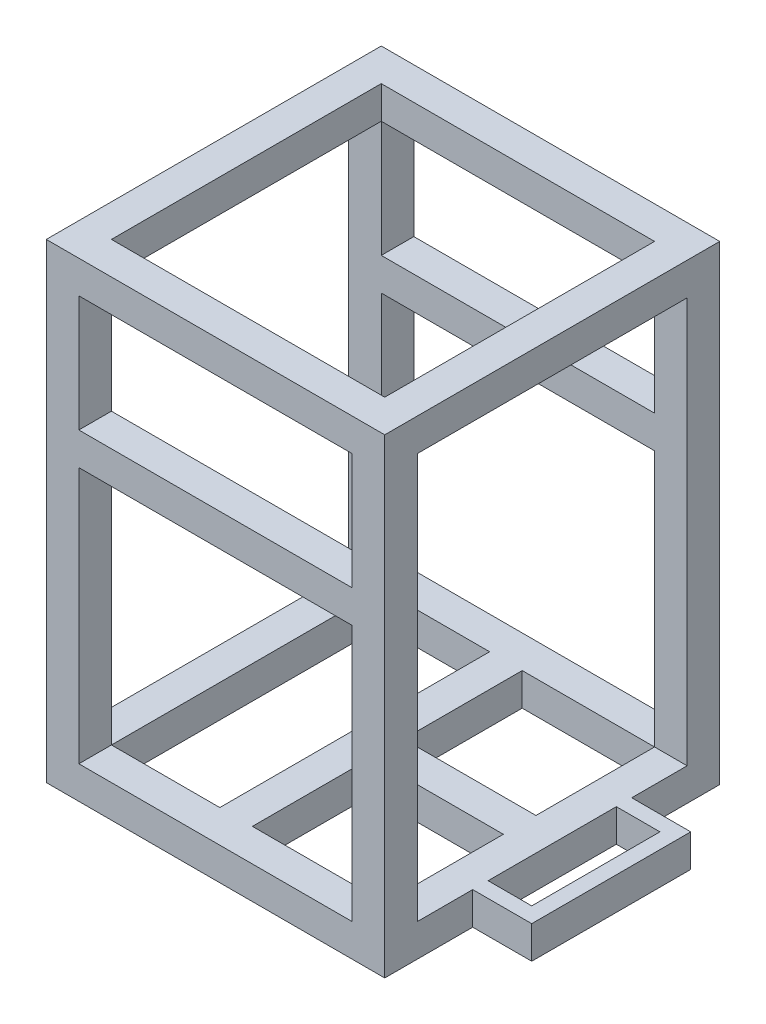
from build123d import *

# Parameters (mm, degrees)
CROQUIS1_W              = 131.9512
CROQUIS1_H              = 130.6
CROQUIS1_W_2            = 42.2512
CROQUIS1_H_2            = 105.2
CROQUIS1_W_3            = 51.6
CROQUIS1_H_3            = 46.25
SALIENTE_EXTRUIR1_DEPTH = 12.7
CROQUIS2_W              = 12.7
CROQUIS2_H              = 12.7
SALIENTE_EXTRUIR2_DEPTH = 158
CROQUIS3_W              = 131.9512
CROQUIS3_H              = 130.6
CROQUIS3_W_2            = 106.5512
CROQUIS3_H_2            = 105.2
SALIENTE_EXTRUIR3_DEPTH = 12.7
SALIENTE_EXTRUIR4_REACH = 256.78
CROQUIS4_W              = 12.7
CROQUIS4_H              = 12.7
SALIENTE_EXTRUIR5_DEPTH = 12.7


with BuildPart() as part:
    # Croquis1 → Saliente-Extruir1 (new body)
    with BuildSketch(Plane(origin=(0, 0, 0), x_dir=(1, 0, 0), z_dir=(0, 1, 0))):
        with Locations((65.9756, 65.3)):
            Rectangle(CROQUIS1_W, CROQUIS1_H)
        with Locations((33.8256, 65.3)):
            Rectangle(CROQUIS1_W_2, CROQUIS1_H_2, mode=Mode.SUBTRACT)
        with Locations((93.4512, 35.825)):
            Rectangle(CROQUIS1_W_3, CROQUIS1_H_3, mode=Mode.SUBTRACT)
        with Locations((93.4512, 94.775)):
            Rectangle(CROQUIS1_W_3, CROQUIS1_H_3, mode=Mode.SUBTRACT)
    extrude(amount=SALIENTE_EXTRUIR1_DEPTH)

    # Croquis2 → Saliente-Extruir2 (add)
    with BuildSketch(Plane(origin=(0, 12.7, 0), x_dir=(1, 0, 0), z_dir=(0, 1, 0))):
        with Locations((6.35, 124.25)):
            Rectangle(CROQUIS2_W, CROQUIS2_H)
        with Locations((6.35, 6.35)):
            Rectangle(CROQUIS2_W, CROQUIS2_H)
        with Locations((125.6012, 124.25)):
            Rectangle(CROQUIS2_W, CROQUIS2_H)
        with Locations((125.6012, 6.35)):
            Rectangle(CROQUIS2_W, CROQUIS2_H)
    extrude(amount=SALIENTE_EXTRUIR2_DEPTH)

    # Croquis3 → Saliente-Extruir3 (add)
    with BuildSketch(Plane(origin=(0, 170.7, 0), x_dir=(1, 0, 0), z_dir=(0, 1, 0))):
        with Locations((65.9756, 65.3)):
            Rectangle(CROQUIS3_W, CROQUIS3_H)
        with Locations((65.9756, 65.3)):
            Rectangle(CROQUIS3_W_2, CROQUIS3_H_2, mode=Mode.SUBTRACT)
    extrude(amount=SALIENTE_EXTRUIR3_DEPTH)

    # Croquis4 → Saliente-Extruir4 (add, up to next)
    with BuildSketch(Plane.ZY.offset(-119.2512), mode=Mode.PRIVATE) as saliente_extruir4_sk1:
        with Locations((-6.35, 119.05)):
            Rectangle(CROQUIS4_W, CROQUIS4_H)
    saliente_extruir4_tool1 = extrude(saliente_extruir4_sk1.sketch, amount=SALIENTE_EXTRUIR4_REACH, mode=Mode.PRIVATE) - part.part
    # Croquis4 → Saliente-Extruir4 (add, up to next)
    with BuildSketch(Plane.ZY.offset(-119.2512), mode=Mode.PRIVATE) as saliente_extruir4_sk2:
        with Locations((-124.25, 119.05)):
            Rectangle(CROQUIS4_W, CROQUIS4_H)
    saliente_extruir4_tool2 = extrude(saliente_extruir4_sk2.sketch, amount=SALIENTE_EXTRUIR4_REACH, mode=Mode.PRIVATE) - part.part
    add(saliente_extruir4_tool1.solids().sort_by_distance((119.2512, 119.05, -6.35))[0])
    add(saliente_extruir4_tool2.solids().sort_by_distance((119.2512, 119.05, -124.25))[0])

    # Croquis5 → Saliente-Extruir5 (add)
    with BuildSketch(Plane(origin=(0, 12.7, 0), x_dir=(1, 0, 0), z_dir=(0, 1, 0))):
        Polygon((131.9512, 96.3), (154.9512, 96.3), (154.9512, 34.3), (131.9512, 34.3), (131.9512, 40.3), (148.9512, 40.3), (148.9512, 90.3), (131.9512, 90.3), align=None)
    extrude(amount=-SALIENTE_EXTRUIR5_DEPTH)


solid = part.part
